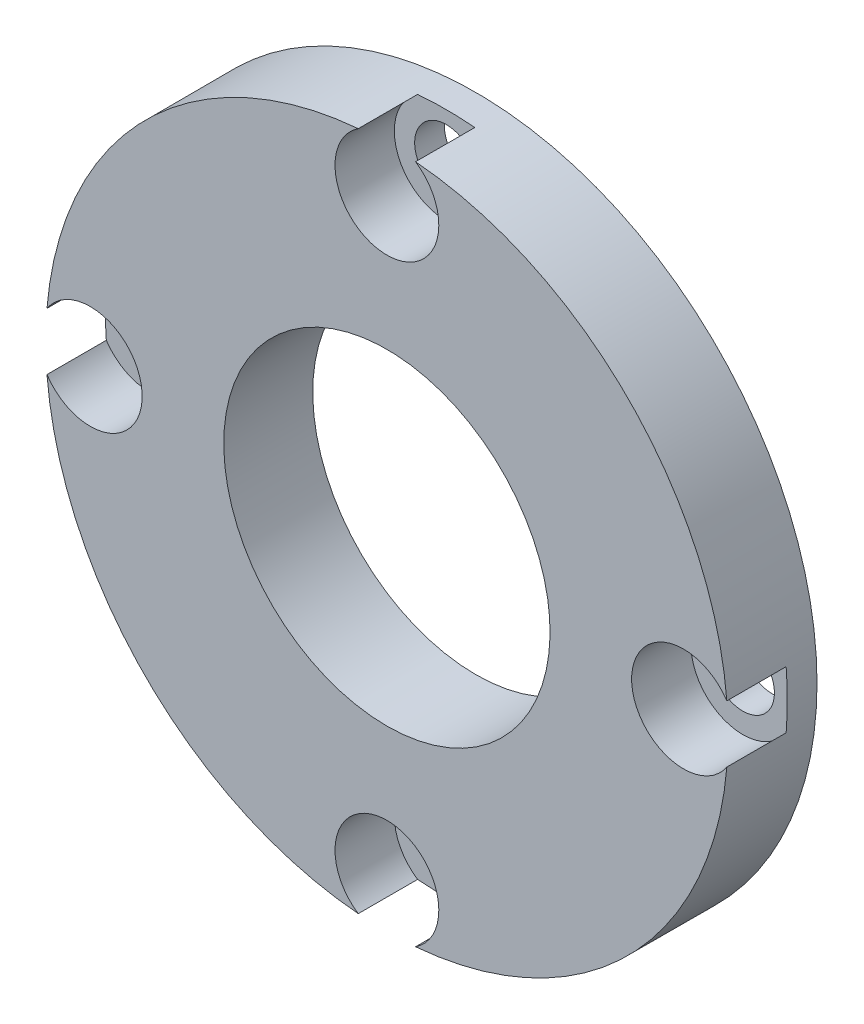
from build123d import *

# Parameters (mm, degrees)
SKETCH1_R                                        = 36.5125
EXTRUDE1_DEPTH                                   = 9.525
SKETCH2_R                                        = 17.4625
SHAFT_THRU_HOLE_DEPTH                            = 53.507627422
CBORE_FOR_1_4_SOCKET_HEAD_CAP_SCREW1_D           = 6.7564
CBORE_FOR_1_4_SOCKET_HEAD_CAP_SCREW1_CBORE_D     = 11.1125
CBORE_FOR_1_4_SOCKET_HEAD_CAP_SCREW1_CBORE_DEPTH = 6.35


with BuildPart() as part:
    # Sketch1 → Extrude1 (new body)
    with BuildSketch(Plane.XY):
        with Locations(Location((0, 0, 0), (0, 0, 180))):
            Circle(SKETCH1_R)
    extrude(amount=EXTRUDE1_DEPTH)

    # Sketch2 → Shaft thru hole (cut, through all)
    with BuildSketch(Plane(origin=(0, 0, 9.525), x_dir=(-1, 0, 0), z_dir=(0, 0, 1))):
        with Locations(Location((0, 0, 0), (0, 0, 90))):
            Circle(SKETCH2_R)
    extrude(amount=-SHAFT_THRU_HOLE_DEPTH, mode=Mode.SUBTRACT)

    # CBORE for 1/4 Socket Head Cap Screw1 (through all)
    with Locations(Plane.XY.offset(9.525)):
        with Locations((0, 31.75), (-31.75, 0), (31.75, 0), (0, -31.75)):
            CounterBoreHole(CBORE_FOR_1_4_SOCKET_HEAD_CAP_SCREW1_D / 2, CBORE_FOR_1_4_SOCKET_HEAD_CAP_SCREW1_CBORE_D / 2, CBORE_FOR_1_4_SOCKET_HEAD_CAP_SCREW1_CBORE_DEPTH)


solid = part.part
